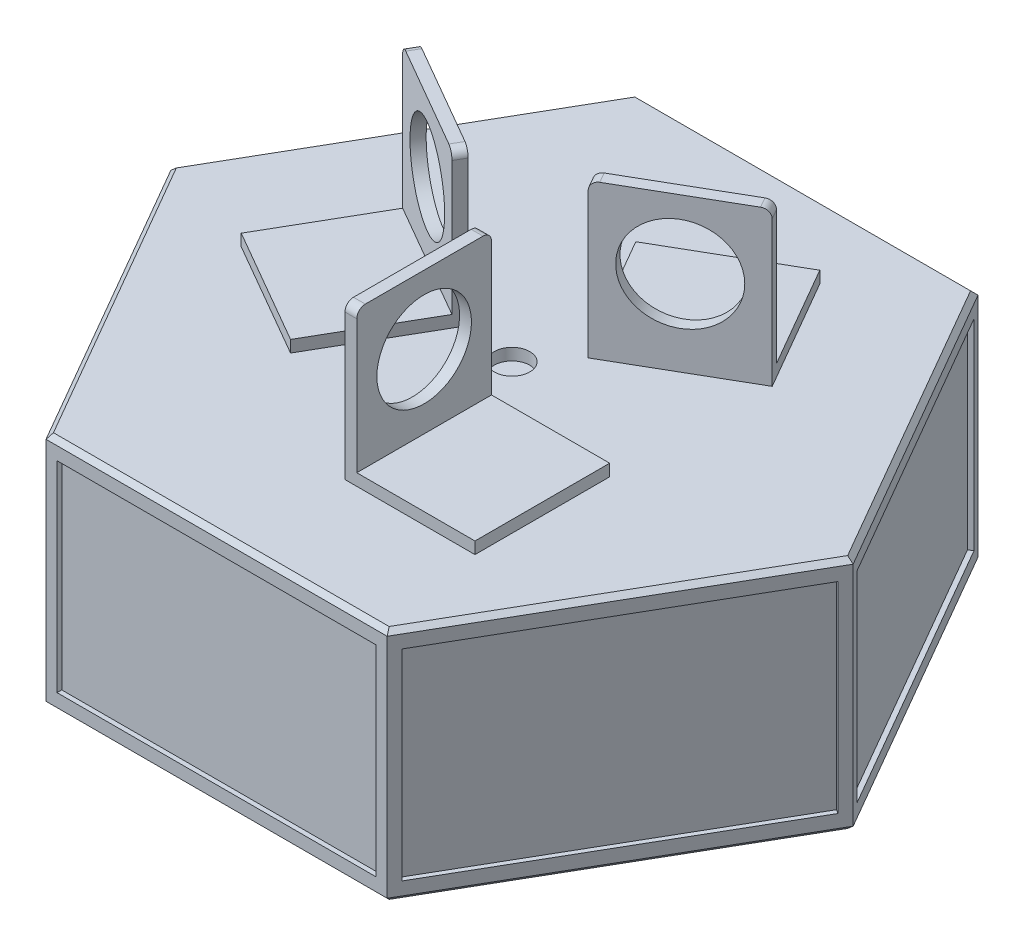
from build123d import *

# Parameters (mm, degrees)
BOSS_EXTRUDE1_DEPTH      = 100
SKETCH2_W                = 5
SKETCH2_H                = 57
BOSS_EXTRUDE2_DEPTH      = 65
SKETCH3_R                = 20
CUT_EXTRUDE1_DEPTH       = 257.915041827
SKETCH7_W                = 57
SKETCH7_H                = 5
BOSS_EXTRUDE3_DEPTH      = 50
FILLET1_R                = 3.6
SKETCH6_W                = 135
SKETCH6_H                = 85
CUT_EXTRUDE2_DEPTH       = 2
CIRPATTERN1_COUNT        = 3
FILLET1_OF_CIRPATTERN1_R = 3.6
CIRPATTERN2_COUNT        = 6
CHAMFER1_SIZE            = 2
SKETCH8_R                = 7.5
CUT_EXTRUDE3_DEPTH       = 5


with BuildPart() as part:
    # Sketch1 → Boss-Extrude1 (new body)
    with BuildSketch(Plane(origin=(0, 0, 0), x_dir=(1, 0, 0), z_dir=(0, 1, 0))):
        Polygon((72.168783649, 125), (-72.168783649, 125), (-144.337567297, 0), (-72.168783649, -125), (72.168783649, -125), (144.337567297, 0), align=None)
    extrude(amount=BOSS_EXTRUDE1_DEPTH)

    # Sketch2 → Boss-Extrude2 (add)
    with BuildSketch(Plane(origin=(0, 100, 0), x_dir=(1, 0, 0), z_dir=(0, 1, 0))):
        with Locations((10.331216351, -50)):
            Rectangle(SKETCH2_W, SKETCH2_H)
    boss_extrude2 = extrude(amount=BOSS_EXTRUDE2_DEPTH)

    # Sketch3 → Cut-Extrude1 (cut, through all)
    with BuildSketch(Plane.ZY.offset(-7.831216351)):
        with Locations((50, 136)):
            Circle(SKETCH3_R)
    cut_extrude1 = extrude(amount=-CUT_EXTRUDE1_DEPTH, mode=Mode.SUBTRACT)

    # Sketch7 → Boss-Extrude3 (add)
    with BuildSketch(Plane(origin=(12.831216351, 0, 0), x_dir=(0, 0, -1), z_dir=(1, 0, 0))):
        with Locations((-50, 102.5)):
            Rectangle(SKETCH7_W, SKETCH7_H)
    boss_extrude3 = extrude(amount=BOSS_EXTRUDE3_DEPTH)

    # Fillet1
    fillet1_edges = [part.edges().sort_by_distance(p)[0] for p in [
        (10.331216351, 165, 21.5),
        (10.331216351, 165, 78.5),
    ]]
    fillet(fillet1_edges, radius=FILLET1_R)

    # Sketch6 → Cut-Extrude2 (cut)
    with BuildSketch(Plane.XY.offset(125)):
        with Locations((0, 50)):
            Rectangle(SKETCH6_W, SKETCH6_H)
    cut_extrude2 = extrude(amount=-CUT_EXTRUDE2_DEPTH, mode=Mode.SUBTRACT)

    # CirPattern1: Boss-Extrude2, Cut-Extrude1, Boss-Extrude3 ×3 about axis
    cirpattern1_axis = Axis((0, 0, 0), (0, 1, 0))
    add([boss_extrude2.rotate(cirpattern1_axis, i * 360 / CIRPATTERN1_COUNT) for i in range(1, CIRPATTERN1_COUNT)])
    add([cut_extrude1.rotate(cirpattern1_axis, i * 360 / CIRPATTERN1_COUNT) for i in range(1, CIRPATTERN1_COUNT)], mode=Mode.SUBTRACT)
    add([boss_extrude3.rotate(cirpattern1_axis, i * 360 / CIRPATTERN1_COUNT) for i in range(1, CIRPATTERN1_COUNT)])

    # Fillet1 of CirPattern1
    fillet1_of_cirpattern1_edges = [part.edges().sort_by_distance(p)[0] for p in [
        (13.453938006, 165, -19.697095812),
        (62.817386021, 165, -48.197095812),
        (-23.785154357, 165, -1.802904188),
        (-73.148602373, 165, -30.302904188),
    ]]
    fillet(fillet1_of_cirpattern1_edges, radius=FILLET1_OF_CIRPATTERN1_R)

    # CirPattern2: Cut-Extrude2 ×6 about axis
    cirpattern2_axis = Axis((0, 0, 0), (0, 1, 0))
    for i in range(1, CIRPATTERN2_COUNT):
        add(cut_extrude2.rotate(cirpattern2_axis, i * 360 / CIRPATTERN2_COUNT), mode=Mode.SUBTRACT)

    # Chamfer1
    chamfer1_edges = [part.edges().sort_by_distance(p)[0] for p in [
        (108.253175473, 0, -62.5),
        (0, 0, -125),
        (-108.253175473, 0, -62.5),
        (-108.253175473, 0, 62.5),
        (108.253175473, 0, 62.5),
        (0, 0, 125),
        (-108.253175473, 100, 62.5),
        (-108.253175473, 100, -62.5),
        (0, 100, -125),
        (108.253175473, 100, -62.5),
        (108.253175473, 100, 62.5),
        (0, 100, 125),
    ]]
    chamfer(chamfer1_edges, length=CHAMFER1_SIZE)

    # Sketch8 → Cut-Extrude3 (cut)
    with BuildSketch(Plane(origin=(0, 100, 0), x_dir=(1, 0, 0), z_dir=(0, 1, 0))):
        Circle(SKETCH8_R)
    extrude(amount=-CUT_EXTRUDE3_DEPTH, mode=Mode.SUBTRACT)


solid = part.part
